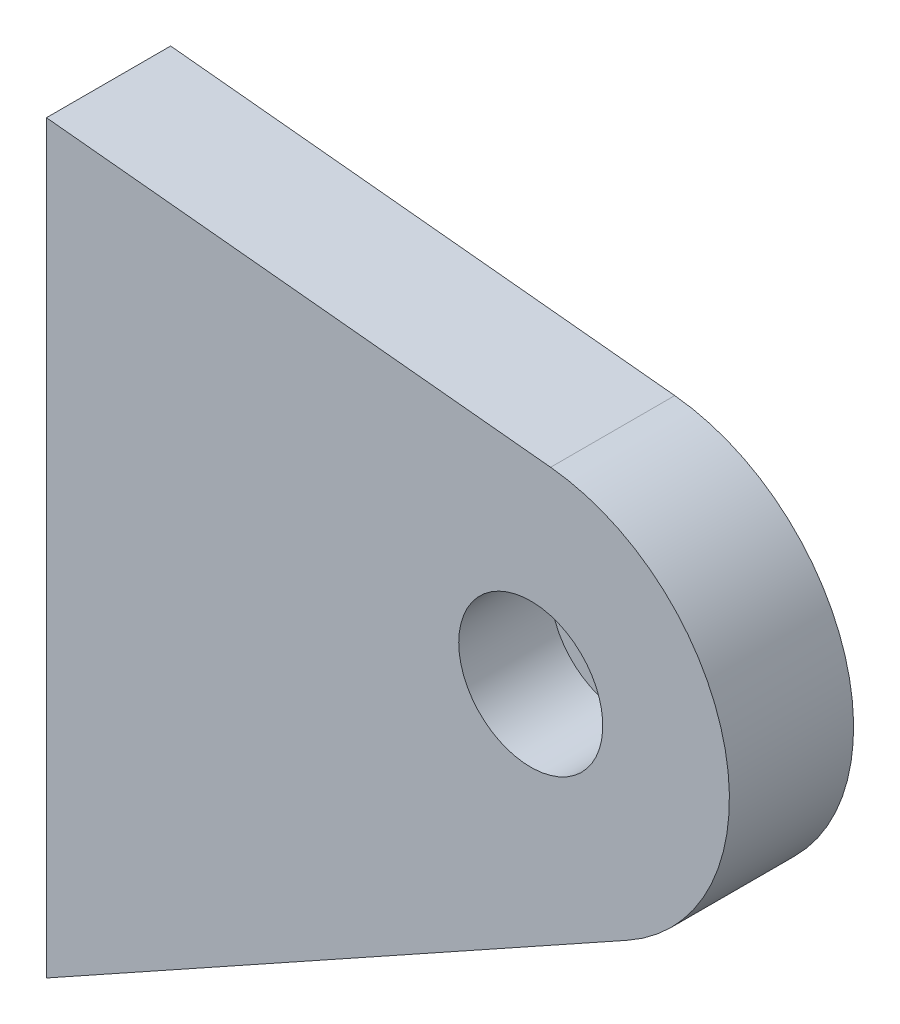
from build123d import *

# Parameters (mm, degrees)
ESQUISSE1_R               = 1.5
EXTRUSION1_DEPTH          = 5
ESQUISSE2_R               = 2.9
ENL_V_MAT_EXTRU_1_DEPTH   = 29.176940927
TROU_TARAUD_M3X0_51_D     = 2.5
TROU_TARAUD_M3X0_51_DEPTH = 9.1
TROU_TARAUD_M3X0_51_TIP   = 0.751075774


with BuildPart() as part:
    # Esquisse1 → Extrusion1 (new body)
    with BuildSketch(Plane.XY):
        with BuildLine():
            Line((0.799950986, 7.959904423), (-19.5, 10))
            Line((-19.5, 10), (-19.5, -20))
            Line((-19.5, -20), (3.888568512, -6.991354299))
            ThreePointArc((3.888568512, -6.991354299), (7.834576447, 1.618459728), (0.799950986, 7.959904423))
        make_face()
        Circle(ESQUISSE1_R, mode=Mode.SUBTRACT)
    extrude(amount=-EXTRUSION1_DEPTH)

    # Esquisse2 → Enlèv. mat.-Extru.1 (cut, through all)
    with BuildSketch(Plane(origin=(0, 0, -3.7), x_dir=(-1, 0, 0), z_dir=(0, 0, -1))):
        Circle(ESQUISSE2_R)
    extrude(amount=-ENL_V_MAT_EXTRU_1_DEPTH, mode=Mode.SUBTRACT)

    # Trou taraudé M3x0.51
    with Locations(Plane.ZY.offset(19.5)):
        with Locations((-2.5, 6), (-2.5, -16)):
            Hole(TROU_TARAUD_M3X0_51_D / 2, depth=TROU_TARAUD_M3X0_51_DEPTH)
            with Locations((0, 0, -(TROU_TARAUD_M3X0_51_DEPTH + TROU_TARAUD_M3X0_51_TIP / 2))):  # 118° drill point
                Cone(0, TROU_TARAUD_M3X0_51_D / 2, TROU_TARAUD_M3X0_51_TIP, mode=Mode.SUBTRACT)


solid = part.part
